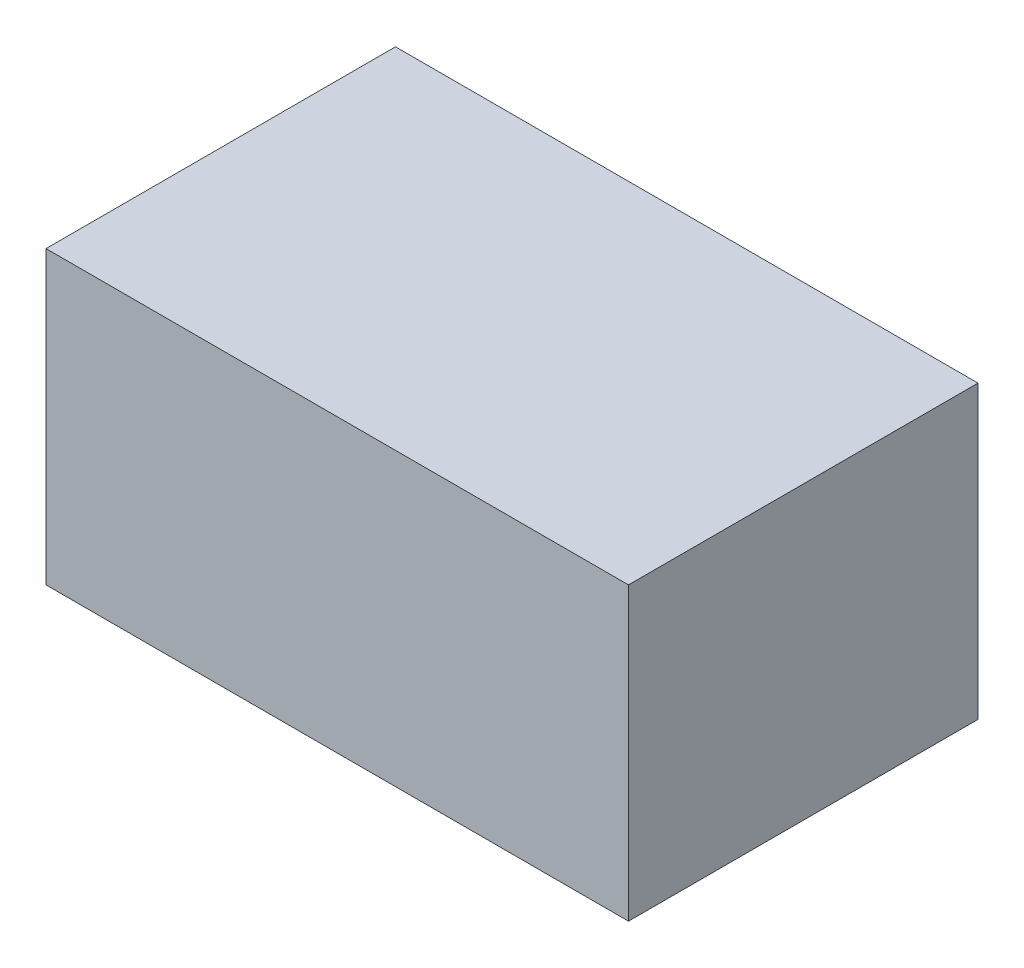
from build123d import *

# Parameters (mm, degrees)
SKETCH1_W           = 1
SKETCH1_H           = 0.6
BOSS_EXTRUDE1_DEPTH = 0.5


with BuildPart() as part:
    # Sketch1 → Boss-Extrude1 (new body)
    with BuildSketch(Plane(origin=(0, 0, 0), x_dir=(1, 0, 0), z_dir=(0, 1, 0))):
        with Locations((0.5, 0.3)):
            Rectangle(SKETCH1_W, SKETCH1_H)
    extrude(amount=BOSS_EXTRUDE1_DEPTH)


solid = part.part
